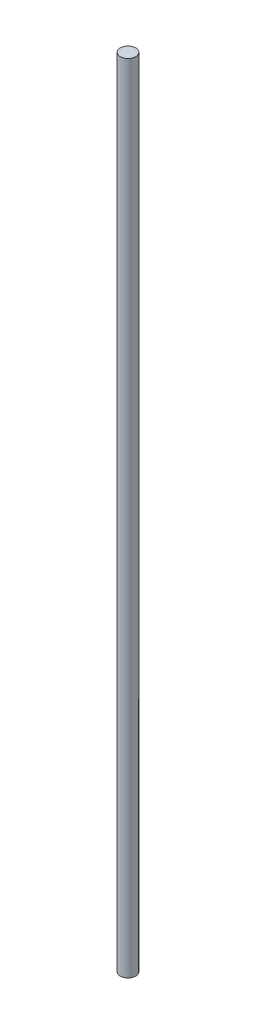
from build123d import *

# Parameters (mm, degrees)
SKETCH1_R           = 6.35
BOSS_EXTRUDE1_DEPTH = 660.4


with BuildPart() as part:
    # Sketch1 → Boss-Extrude1 (new body)
    with BuildSketch(Plane(origin=(0, 0, 0), x_dir=(1, 0, 0), z_dir=(0, 1, 0))):
        with Locations(Location((0, 0, 0), (0, 0, 270))):
            Circle(SKETCH1_R)
    extrude(amount=BOSS_EXTRUDE1_DEPTH)


solid = part.part
